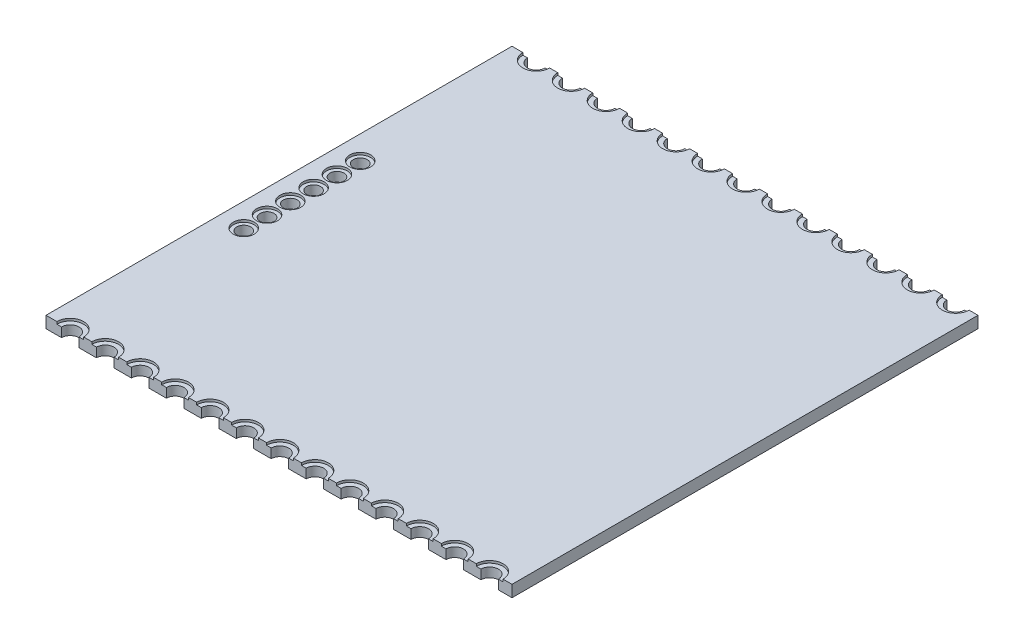
from build123d import *

# Parameters (mm, degrees)
IZIM1_W                     = 40
IZIM1_H                     = 40
Y_KSEKLIK_EKSTR_ZYON1_DEPTH = 1
IZIM2_R                     = 0.598614151
KES_EKSTR_ZYON1_DEPTH       = 2
L_O_ALTMA1_COUNT            = 6
L_O_ALTMA1_PITCH            = 2
IZIM3_R                     = 0.898614151
KES_EKSTR_ZYON2_DEPTH       = 0.2
L_O_ALTMA3_COUNT            = 6
L_O_ALTMA3_PITCH            = 2
KES_EKSTR_ZYON3_DEPTH       = 1.2
KES_EKSTR_ZYON4_DEPTH       = 0.2
L_O_ALTMA4_COUNT            = 13
L_O_ALTMA4_PITCH            = 3
AYNALAMA1_COPY_1_DEPTH      = 1.2
AYNALAMA1_COPY_2_DEPTH      = 1.2
AYNALAMA1_COPY_3_DEPTH      = 1.2
AYNALAMA1_COPY_4_DEPTH      = 1.2
AYNALAMA1_COPY_5_DEPTH      = 1.2
AYNALAMA1_COPY_6_DEPTH      = 1.2
AYNALAMA1_COPY_7_DEPTH      = 1.2
AYNALAMA1_COPY_8_DEPTH      = 1.2
AYNALAMA1_COPY_9_DEPTH      = 1.2
AYNALAMA1_COPY_10_DEPTH     = 1.2
AYNALAMA1_COPY_11_DEPTH     = 1.2
AYNALAMA1_COPY_12_DEPTH     = 1.2
AYNALAMA1_COPY_13_DEPTH     = 0.2
AYNALAMA1_COPY_14_DEPTH     = 0.2
AYNALAMA1_COPY_15_DEPTH     = 0.2
AYNALAMA1_COPY_16_DEPTH     = 0.2
AYNALAMA1_COPY_17_DEPTH     = 0.2
AYNALAMA1_COPY_18_DEPTH     = 0.2
AYNALAMA1_COPY_19_DEPTH     = 0.2
AYNALAMA1_COPY_20_DEPTH     = 0.2
AYNALAMA1_COPY_21_DEPTH     = 0.2
AYNALAMA1_COPY_22_DEPTH     = 0.2
AYNALAMA1_COPY_23_DEPTH     = 0.2
AYNALAMA1_COPY_24_DEPTH     = 0.2


with BuildPart() as part:
    # Çizim1 → Yükseklik-Ekstrüzyon1 (new body)
    with BuildSketch(Plane(origin=(0, 0, 0), x_dir=(1, 0, 0), z_dir=(0, 1, 0))):
        Rectangle(IZIM1_W, IZIM1_H)
    extrude(amount=Y_KSEKLIK_EKSTR_ZYON1_DEPTH)

    # Çizim2 → Kes-Ekstrüzyon1 (cut)
    with BuildSketch(Plane(origin=(0, 1, 1.355445714), x_dir=(1, 0, 0), z_dir=(0, 1, 0))):
        with Locations(Location((-17.990003602, 6.317917931, 0), (0, 0, 270))):
            Circle(IZIM2_R)
    kes_ekstr_zyon1 = extrude(amount=-KES_EKSTR_ZYON1_DEPTH, mode=Mode.SUBTRACT)

    # LÇoğaltma1: Kes-Ekstrüzyon1 ×6
    with Locations(*[(0, 0, i * L_O_ALTMA1_PITCH) for i in range(1, L_O_ALTMA1_COUNT)]):
        add(kes_ekstr_zyon1, mode=Mode.SUBTRACT)

    # Çizim3 → Kes-Ekstrüzyon2 (cut)
    with BuildSketch(Plane(origin=(0, 1, 0), x_dir=(1, 0, 0), z_dir=(0, 1, 0))):
        with Locations(Location((-17.990003602, 4.962472217, 0), (0, 0, 270))):
            Circle(IZIM3_R)
    kes_ekstr_zyon2 = extrude(amount=-KES_EKSTR_ZYON2_DEPTH, mode=Mode.SUBTRACT)

    # LÇoğaltma3: Kes-Ekstrüzyon2 ×6
    with Locations(*[(0, 0, i * L_O_ALTMA3_PITCH) for i in range(1, L_O_ALTMA3_COUNT)]):
        add(kes_ekstr_zyon2, mode=Mode.SUBTRACT)

    # Çizim4 → Kes-Ekstrüzyon3 (cut)
    with BuildSketch(Plane(origin=(0, 1, 0), x_dir=(1, 0, 0), z_dir=(0, 1, 0))):
        with BuildLine():
            Line((-18.667614776, -20), (-17.167614776, -20))
            ThreePointArc((-17.167614776, -20), (-17.917614776, -19.25), (-18.667614776, -20))
        make_face()
    kes_ekstr_zyon3 = extrude(amount=-KES_EKSTR_ZYON3_DEPTH, mode=Mode.SUBTRACT)

    # Çizim5 → Kes-Ekstrüzyon4 (cut)
    with BuildSketch(Plane(origin=(0, 1, 0), x_dir=(1, 0, 0), z_dir=(0, 1, 0))):
        with BuildLine():
            Line((-19.067614776, -20), (-18.667614776, -20))
            ThreePointArc((-18.667614776, -20), (-17.917614776, -19.25), (-17.167614776, -20))
            Line((-17.167614776, -20), (-16.767614776, -20))
            ThreePointArc((-16.767614776, -20), (-17.917614776, -18.85), (-19.067614776, -20))
        make_face()
    kes_ekstr_zyon4 = extrude(amount=-KES_EKSTR_ZYON4_DEPTH, mode=Mode.SUBTRACT)

    # LÇoğaltma4: Kes-Ekstrüzyon3, Kes-Ekstrüzyon4 ×13
    with Locations(*[(i * L_O_ALTMA4_PITCH, 0, 0) for i in range(1, L_O_ALTMA4_COUNT)]):
        add(kes_ekstr_zyon3, mode=Mode.SUBTRACT)
        add(kes_ekstr_zyon4, mode=Mode.SUBTRACT)

    # Aynalama1: Kes-Ekstrüzyon3, Kes-Ekstrüzyon4 across plane
    add(kes_ekstr_zyon3.mirror(Plane.XY), mode=Mode.SUBTRACT)
    add(kes_ekstr_zyon4.mirror(Plane.XY), mode=Mode.SUBTRACT)

    # Aynalama1 copy 1 sketch → Aynalama1 copy 1 (cut)
    with BuildSketch(Plane(origin=(3, 1, 0), x_dir=(1, 0, 0), z_dir=(0, 1, 0))):
        with BuildLine():
            Line((-18.667614776, 20), (-17.167614776, 20))
            ThreePointArc((-17.167614776, 20), (-17.917614776, 19.25), (-18.667614776, 20))
        make_face()
    extrude(amount=-AYNALAMA1_COPY_1_DEPTH, mode=Mode.SUBTRACT)

    # Aynalama1 copy 2 sketch → Aynalama1 copy 2 (cut)
    with BuildSketch(Plane(origin=(6, 1, 0), x_dir=(1, 0, 0), z_dir=(0, 1, 0))):
        with BuildLine():
            Line((-18.667614776, 20), (-17.167614776, 20))
            ThreePointArc((-17.167614776, 20), (-17.917614776, 19.25), (-18.667614776, 20))
        make_face()
    extrude(amount=-AYNALAMA1_COPY_2_DEPTH, mode=Mode.SUBTRACT)

    # Aynalama1 copy 3 sketch → Aynalama1 copy 3 (cut)
    with BuildSketch(Plane(origin=(9, 1, 0), x_dir=(1, 0, 0), z_dir=(0, 1, 0))):
        with BuildLine():
            Line((-18.667614776, 20), (-17.167614776, 20))
            ThreePointArc((-17.167614776, 20), (-17.917614776, 19.25), (-18.667614776, 20))
        make_face()
    extrude(amount=-AYNALAMA1_COPY_3_DEPTH, mode=Mode.SUBTRACT)

    # Aynalama1 copy 4 sketch → Aynalama1 copy 4 (cut)
    with BuildSketch(Plane(origin=(12, 1, 0), x_dir=(1, 0, 0), z_dir=(0, 1, 0))):
        with BuildLine():
            Line((-18.667614776, 20), (-17.167614776, 20))
            ThreePointArc((-17.167614776, 20), (-17.917614776, 19.25), (-18.667614776, 20))
        make_face()
    extrude(amount=-AYNALAMA1_COPY_4_DEPTH, mode=Mode.SUBTRACT)

    # Aynalama1 copy 5 sketch → Aynalama1 copy 5 (cut)
    with BuildSketch(Plane(origin=(15, 1, 0), x_dir=(1, 0, 0), z_dir=(0, 1, 0))):
        with BuildLine():
            Line((-18.667614776, 20), (-17.167614776, 20))
            ThreePointArc((-17.167614776, 20), (-17.917614776, 19.25), (-18.667614776, 20))
        make_face()
    extrude(amount=-AYNALAMA1_COPY_5_DEPTH, mode=Mode.SUBTRACT)

    # Aynalama1 copy 6 sketch → Aynalama1 copy 6 (cut)
    with BuildSketch(Plane(origin=(18, 1, 0), x_dir=(1, 0, 0), z_dir=(0, 1, 0))):
        with BuildLine():
            Line((-18.667614776, 20), (-17.167614776, 20))
            ThreePointArc((-17.167614776, 20), (-17.917614776, 19.25), (-18.667614776, 20))
        make_face()
    extrude(amount=-AYNALAMA1_COPY_6_DEPTH, mode=Mode.SUBTRACT)

    # Aynalama1 copy 7 sketch → Aynalama1 copy 7 (cut)
    with BuildSketch(Plane(origin=(21, 1, 0), x_dir=(1, 0, 0), z_dir=(0, 1, 0))):
        with BuildLine():
            Line((-18.667614776, 20), (-17.167614776, 20))
            ThreePointArc((-17.167614776, 20), (-17.917614776, 19.25), (-18.667614776, 20))
        make_face()
    extrude(amount=-AYNALAMA1_COPY_7_DEPTH, mode=Mode.SUBTRACT)

    # Aynalama1 copy 8 sketch → Aynalama1 copy 8 (cut)
    with BuildSketch(Plane(origin=(24, 1, 0), x_dir=(1, 0, 0), z_dir=(0, 1, 0))):
        with BuildLine():
            Line((-18.667614776, 20), (-17.167614776, 20))
            ThreePointArc((-17.167614776, 20), (-17.917614776, 19.25), (-18.667614776, 20))
        make_face()
    extrude(amount=-AYNALAMA1_COPY_8_DEPTH, mode=Mode.SUBTRACT)

    # Aynalama1 copy 9 sketch → Aynalama1 copy 9 (cut)
    with BuildSketch(Plane(origin=(27, 1, 0), x_dir=(1, 0, 0), z_dir=(0, 1, 0))):
        with BuildLine():
            Line((-18.667614776, 20), (-17.167614776, 20))
            ThreePointArc((-17.167614776, 20), (-17.917614776, 19.25), (-18.667614776, 20))
        make_face()
    extrude(amount=-AYNALAMA1_COPY_9_DEPTH, mode=Mode.SUBTRACT)

    # Aynalama1 copy 10 sketch → Aynalama1 copy 10 (cut)
    with BuildSketch(Plane(origin=(30, 1, 0), x_dir=(1, 0, 0), z_dir=(0, 1, 0))):
        with BuildLine():
            Line((-18.667614776, 20), (-17.167614776, 20))
            ThreePointArc((-17.167614776, 20), (-17.917614776, 19.25), (-18.667614776, 20))
        make_face()
    extrude(amount=-AYNALAMA1_COPY_10_DEPTH, mode=Mode.SUBTRACT)

    # Aynalama1 copy 11 sketch → Aynalama1 copy 11 (cut)
    with BuildSketch(Plane(origin=(33, 1, 0), x_dir=(1, 0, 0), z_dir=(0, 1, 0))):
        with BuildLine():
            Line((-18.667614776, 20), (-17.167614776, 20))
            ThreePointArc((-17.167614776, 20), (-17.917614776, 19.25), (-18.667614776, 20))
        make_face()
    extrude(amount=-AYNALAMA1_COPY_11_DEPTH, mode=Mode.SUBTRACT)

    # Aynalama1 copy 12 sketch → Aynalama1 copy 12 (cut)
    with BuildSketch(Plane(origin=(36, 1, 0), x_dir=(1, 0, 0), z_dir=(0, 1, 0))):
        with BuildLine():
            Line((-18.667614776, 20), (-17.167614776, 20))
            ThreePointArc((-17.167614776, 20), (-17.917614776, 19.25), (-18.667614776, 20))
        make_face()
    extrude(amount=-AYNALAMA1_COPY_12_DEPTH, mode=Mode.SUBTRACT)

    # Aynalama1 copy 13 sketch → Aynalama1 copy 13 (cut)
    with BuildSketch(Plane(origin=(3, 1, 0), x_dir=(1, 0, 0), z_dir=(0, 1, 0))):
        with BuildLine():
            Line((-19.067614776, 20), (-18.667614776, 20))
            ThreePointArc((-18.667614776, 20), (-17.917614776, 19.25), (-17.167614776, 20))
            Line((-17.167614776, 20), (-16.767614776, 20))
            ThreePointArc((-16.767614776, 20), (-17.917614776, 18.85), (-19.067614776, 20))
        make_face()
    extrude(amount=-AYNALAMA1_COPY_13_DEPTH, mode=Mode.SUBTRACT)

    # Aynalama1 copy 14 sketch → Aynalama1 copy 14 (cut)
    with BuildSketch(Plane(origin=(6, 1, 0), x_dir=(1, 0, 0), z_dir=(0, 1, 0))):
        with BuildLine():
            Line((-19.067614776, 20), (-18.667614776, 20))
            ThreePointArc((-18.667614776, 20), (-17.917614776, 19.25), (-17.167614776, 20))
            Line((-17.167614776, 20), (-16.767614776, 20))
            ThreePointArc((-16.767614776, 20), (-17.917614776, 18.85), (-19.067614776, 20))
        make_face()
    extrude(amount=-AYNALAMA1_COPY_14_DEPTH, mode=Mode.SUBTRACT)

    # Aynalama1 copy 15 sketch → Aynalama1 copy 15 (cut)
    with BuildSketch(Plane(origin=(9, 1, 0), x_dir=(1, 0, 0), z_dir=(0, 1, 0))):
        with BuildLine():
            Line((-19.067614776, 20), (-18.667614776, 20))
            ThreePointArc((-18.667614776, 20), (-17.917614776, 19.25), (-17.167614776, 20))
            Line((-17.167614776, 20), (-16.767614776, 20))
            ThreePointArc((-16.767614776, 20), (-17.917614776, 18.85), (-19.067614776, 20))
        make_face()
    extrude(amount=-AYNALAMA1_COPY_15_DEPTH, mode=Mode.SUBTRACT)

    # Aynalama1 copy 16 sketch → Aynalama1 copy 16 (cut)
    with BuildSketch(Plane(origin=(12, 1, 0), x_dir=(1, 0, 0), z_dir=(0, 1, 0))):
        with BuildLine():
            Line((-19.067614776, 20), (-18.667614776, 20))
            ThreePointArc((-18.667614776, 20), (-17.917614776, 19.25), (-17.167614776, 20))
            Line((-17.167614776, 20), (-16.767614776, 20))
            ThreePointArc((-16.767614776, 20), (-17.917614776, 18.85), (-19.067614776, 20))
        make_face()
    extrude(amount=-AYNALAMA1_COPY_16_DEPTH, mode=Mode.SUBTRACT)

    # Aynalama1 copy 17 sketch → Aynalama1 copy 17 (cut)
    with BuildSketch(Plane(origin=(15, 1, 0), x_dir=(1, 0, 0), z_dir=(0, 1, 0))):
        with BuildLine():
            Line((-19.067614776, 20), (-18.667614776, 20))
            ThreePointArc((-18.667614776, 20), (-17.917614776, 19.25), (-17.167614776, 20))
            Line((-17.167614776, 20), (-16.767614776, 20))
            ThreePointArc((-16.767614776, 20), (-17.917614776, 18.85), (-19.067614776, 20))
        make_face()
    extrude(amount=-AYNALAMA1_COPY_17_DEPTH, mode=Mode.SUBTRACT)

    # Aynalama1 copy 18 sketch → Aynalama1 copy 18 (cut)
    with BuildSketch(Plane(origin=(18, 1, 0), x_dir=(1, 0, 0), z_dir=(0, 1, 0))):
        with BuildLine():
            Line((-19.067614776, 20), (-18.667614776, 20))
            ThreePointArc((-18.667614776, 20), (-17.917614776, 19.25), (-17.167614776, 20))
            Line((-17.167614776, 20), (-16.767614776, 20))
            ThreePointArc((-16.767614776, 20), (-17.917614776, 18.85), (-19.067614776, 20))
        make_face()
    extrude(amount=-AYNALAMA1_COPY_18_DEPTH, mode=Mode.SUBTRACT)

    # Aynalama1 copy 19 sketch → Aynalama1 copy 19 (cut)
    with BuildSketch(Plane(origin=(21, 1, 0), x_dir=(1, 0, 0), z_dir=(0, 1, 0))):
        with BuildLine():
            Line((-19.067614776, 20), (-18.667614776, 20))
            ThreePointArc((-18.667614776, 20), (-17.917614776, 19.25), (-17.167614776, 20))
            Line((-17.167614776, 20), (-16.767614776, 20))
            ThreePointArc((-16.767614776, 20), (-17.917614776, 18.85), (-19.067614776, 20))
        make_face()
    extrude(amount=-AYNALAMA1_COPY_19_DEPTH, mode=Mode.SUBTRACT)

    # Aynalama1 copy 20 sketch → Aynalama1 copy 20 (cut)
    with BuildSketch(Plane(origin=(24, 1, 0), x_dir=(1, 0, 0), z_dir=(0, 1, 0))):
        with BuildLine():
            Line((-19.067614776, 20), (-18.667614776, 20))
            ThreePointArc((-18.667614776, 20), (-17.917614776, 19.25), (-17.167614776, 20))
            Line((-17.167614776, 20), (-16.767614776, 20))
            ThreePointArc((-16.767614776, 20), (-17.917614776, 18.85), (-19.067614776, 20))
        make_face()
    extrude(amount=-AYNALAMA1_COPY_20_DEPTH, mode=Mode.SUBTRACT)

    # Aynalama1 copy 21 sketch → Aynalama1 copy 21 (cut)
    with BuildSketch(Plane(origin=(27, 1, 0), x_dir=(1, 0, 0), z_dir=(0, 1, 0))):
        with BuildLine():
            Line((-19.067614776, 20), (-18.667614776, 20))
            ThreePointArc((-18.667614776, 20), (-17.917614776, 19.25), (-17.167614776, 20))
            Line((-17.167614776, 20), (-16.767614776, 20))
            ThreePointArc((-16.767614776, 20), (-17.917614776, 18.85), (-19.067614776, 20))
        make_face()
    extrude(amount=-AYNALAMA1_COPY_21_DEPTH, mode=Mode.SUBTRACT)

    # Aynalama1 copy 22 sketch → Aynalama1 copy 22 (cut)
    with BuildSketch(Plane(origin=(30, 1, 0), x_dir=(1, 0, 0), z_dir=(0, 1, 0))):
        with BuildLine():
            Line((-19.067614776, 20), (-18.667614776, 20))
            ThreePointArc((-18.667614776, 20), (-17.917614776, 19.25), (-17.167614776, 20))
            Line((-17.167614776, 20), (-16.767614776, 20))
            ThreePointArc((-16.767614776, 20), (-17.917614776, 18.85), (-19.067614776, 20))
        make_face()
    extrude(amount=-AYNALAMA1_COPY_22_DEPTH, mode=Mode.SUBTRACT)

    # Aynalama1 copy 23 sketch → Aynalama1 copy 23 (cut)
    with BuildSketch(Plane(origin=(33, 1, 0), x_dir=(1, 0, 0), z_dir=(0, 1, 0))):
        with BuildLine():
            Line((-19.067614776, 20), (-18.667614776, 20))
            ThreePointArc((-18.667614776, 20), (-17.917614776, 19.25), (-17.167614776, 20))
            Line((-17.167614776, 20), (-16.767614776, 20))
            ThreePointArc((-16.767614776, 20), (-17.917614776, 18.85), (-19.067614776, 20))
        make_face()
    extrude(amount=-AYNALAMA1_COPY_23_DEPTH, mode=Mode.SUBTRACT)

    # Aynalama1 copy 24 sketch → Aynalama1 copy 24 (cut)
    with BuildSketch(Plane(origin=(36, 1, 0), x_dir=(1, 0, 0), z_dir=(0, 1, 0))):
        with BuildLine():
            Line((-19.067614776, 20), (-18.667614776, 20))
            ThreePointArc((-18.667614776, 20), (-17.917614776, 19.25), (-17.167614776, 20))
            Line((-17.167614776, 20), (-16.767614776, 20))
            ThreePointArc((-16.767614776, 20), (-17.917614776, 18.85), (-19.067614776, 20))
        make_face()
    extrude(amount=-AYNALAMA1_COPY_24_DEPTH, mode=Mode.SUBTRACT)


solid = part.part
